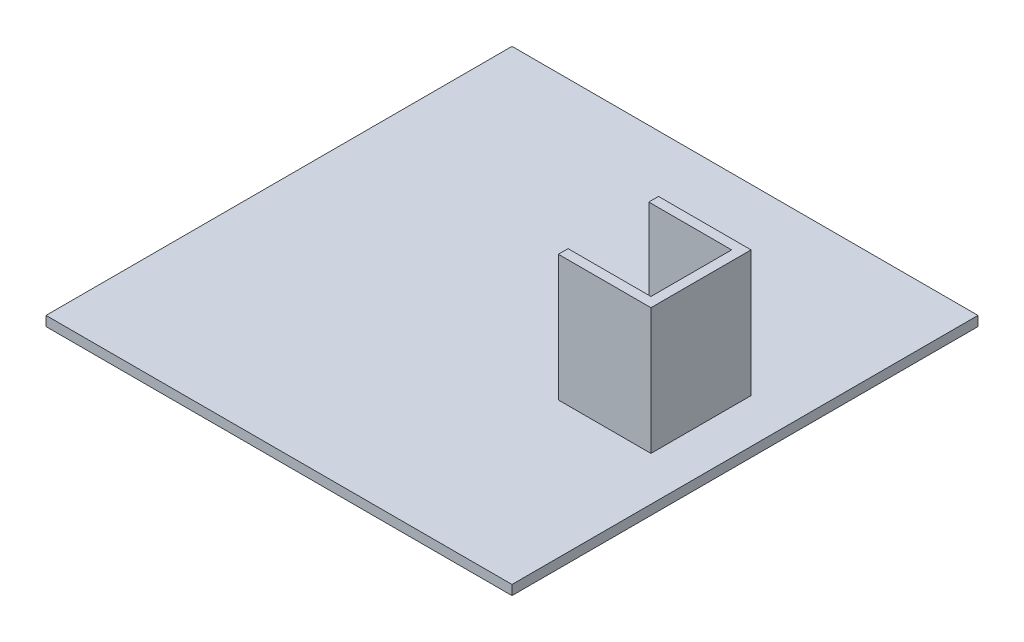
from build123d import *

# Parameters (mm, degrees)
SKETCH1_W           = 152.4
SKETCH1_H           = 152.4
BOSS_EXTRUDE1_DEPTH = 3.175
BOSS_EXTRUDE2_DEPTH = 41.275


with BuildPart() as part:
    # Sketch1 → Boss-Extrude1 (new body)
    with BuildSketch(Plane(origin=(0, 0, 0), x_dir=(1, 0, 0), z_dir=(0, 1, 0))):
        Rectangle(SKETCH1_W, SKETCH1_H)
    extrude(amount=BOSS_EXTRUDE1_DEPTH)

    # Sketch2 → Boss-Extrude2 (add)
    with BuildSketch(Plane(origin=(0, 3.175, 0), x_dir=(1, 0, 0), z_dir=(0, 1, 0))):
        Polygon((58.635483549, 13.2), (58.635483549, -13.2), (31.535483549, -13.2), (31.535483549, -16.375), (61.810483549, -16.375), (61.810483549, 16.375), (31.535483549, 16.375), (31.535483549, 13.2), align=None)
    extrude(amount=BOSS_EXTRUDE2_DEPTH)


solid = part.part
